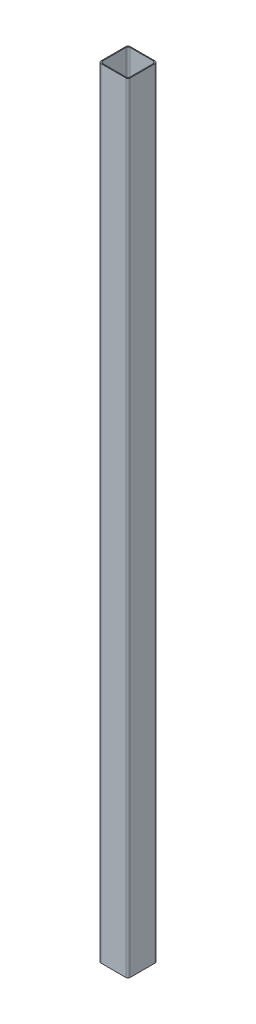
from build123d import *

# Parameters (mm, degrees)
ESBO_O1_W                = 40
ESBO_O1_H                = 40
ESBO_O1_W_2              = 37.6
ESBO_O1_H_2              = 37.6
RESSALTO_EXTRUS_O1_DEPTH = 530
FILETE1_R                = 3


with BuildPart() as part:
    # Esboço1 → Ressalto-extrusão1 (new, symmetric)
    with BuildSketch(Plane(origin=(0, 0, 0), x_dir=(1, 0, 0), z_dir=(0, 1, 0))):
        Rectangle(ESBO_O1_W, ESBO_O1_H)
        Rectangle(ESBO_O1_W_2, ESBO_O1_H_2, mode=Mode.SUBTRACT)
    extrude(amount=RESSALTO_EXTRUS_O1_DEPTH, both=True)

    # Filete1
    filete1_edges = [part.edges().sort_by_distance(p)[0] for p in [
        (-18.8, 0, 18.8),
        (18.8, 0, 18.8),
        (18.8, 0, -18.8),
        (-18.8, 0, -18.8),
        (-20, 0, -20),
        (20, 0, -20),
        (20, 0, 20),
        (-20, 0, 20),
    ]]
    fillet(filete1_edges, radius=FILETE1_R)


solid = part.part
